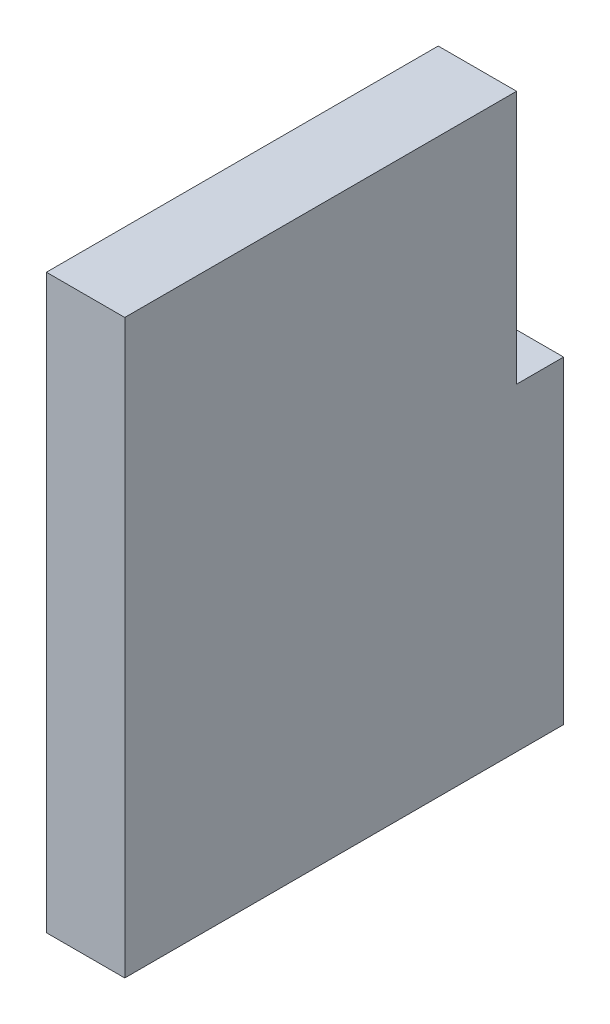
from build123d import *

# Parameters (mm, degrees)
SKETCH1_W           = 20
SKETCH1_H           = 100
BOSS_EXTRUDE1_DEPTH = 146
SKETCH2_W           = 20
SKETCH2_H           = 81.25
BOSS_EXTRUDE2_DEPTH = 12


with BuildPart() as part:
    # Sketch1 → Boss-Extrude1 (new body)
    with BuildSketch(Plane(origin=(0, 0, 0), x_dir=(1, 0, 0), z_dir=(0, 1, 0))):
        with Locations((10, -50)):
            Rectangle(SKETCH1_W, SKETCH1_H)
    extrude(amount=BOSS_EXTRUDE1_DEPTH)

    # Sketch2 → Boss-Extrude2 (add)
    with BuildSketch(Plane(origin=(0, 0, 0), x_dir=(-1, 0, 0), z_dir=(0, 0, -1))):
        with Locations((-10, 40.625)):
            Rectangle(SKETCH2_W, SKETCH2_H)
    extrude(amount=BOSS_EXTRUDE2_DEPTH)


solid = part.part
